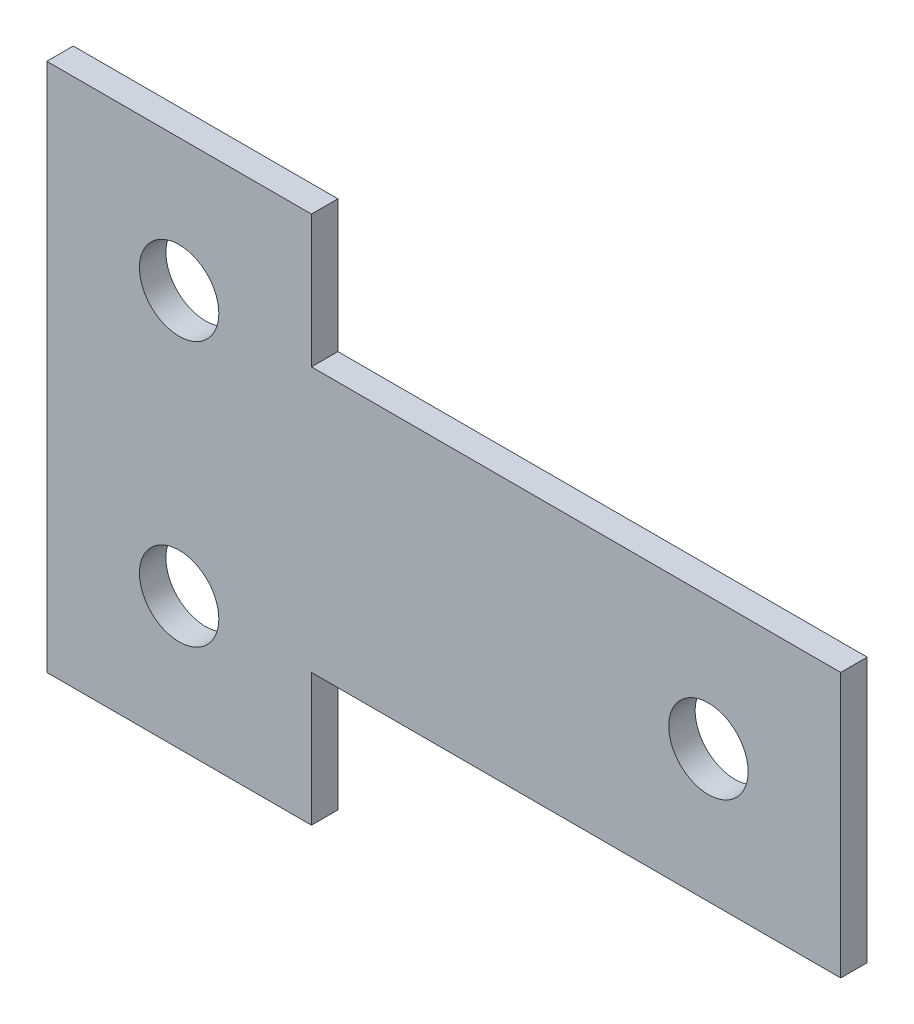
from build123d import *

# Parameters (mm, degrees)
SZKIC1_W                    = 40
SZKIC1_H                    = 20
SZKIC1_W_2                  = 20
SZKIC1_H_2                  = 40
DODANIE_WYCI_GNI_CIE1_DEPTH = 2
SZKIC2_R                    = 3
WYTNIJ_WYCI_GNI_CIE1_DEPTH  = 2


with BuildPart() as part:
    # Szkic1 → Dodanie-wyciągnięcie1 (new body)
    with BuildSketch(Plane.XY):
        with Locations((-19.435499515, 2.2)):
            Rectangle(SZKIC1_W, SZKIC1_H)
        with Locations((-49.435499515, 2.2)):
            Rectangle(SZKIC1_W_2, SZKIC1_H_2)
    extrude(amount=DODANIE_WYCI_GNI_CIE1_DEPTH)

    # Szkic2 → Wytnij-wyciągnięcie1 (cut)
    with BuildSketch(Plane.XY.offset(2)):
        with Locations((-9.435499515, 2.2)):
            Circle(SZKIC2_R)
        with Locations((-49.435499515, 12.2)):
            Circle(SZKIC2_R)
        with Locations((-49.435499515, -7.8)):
            Circle(SZKIC2_R)
    extrude(amount=-WYTNIJ_WYCI_GNI_CIE1_DEPTH, mode=Mode.SUBTRACT)


solid = part.part
